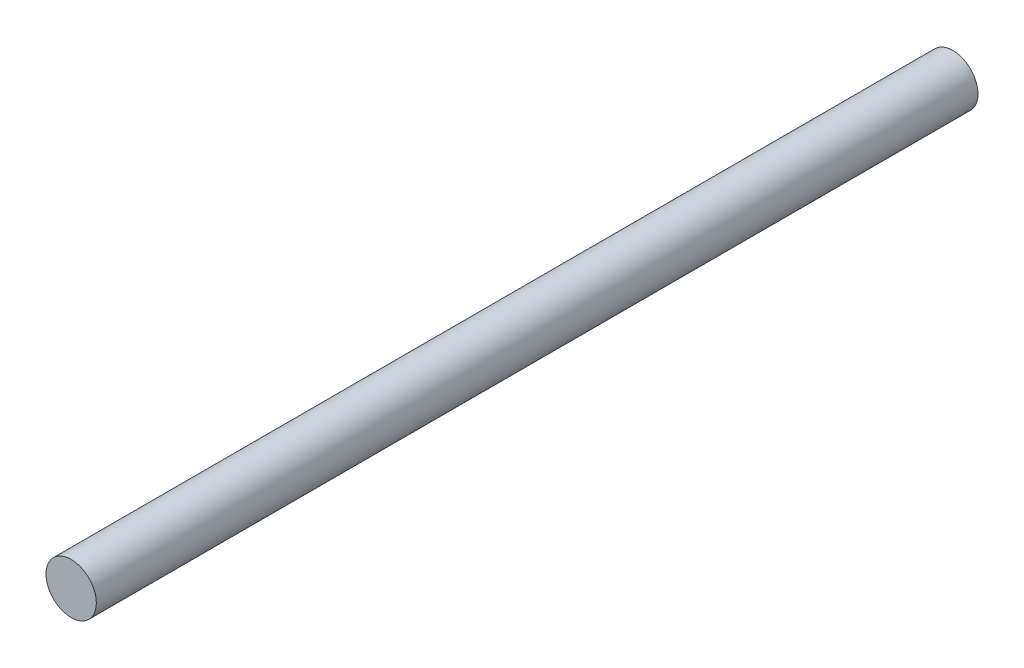
from build123d import *

# Parameters (mm, degrees)
ESBO_O1_R                = 4
RESSALTO_EXTRUS_O1_DEPTH = 140


with BuildPart() as part:
    # Esboço1 → Ressalto-extrusão1 (new body)
    with BuildSketch(Plane.XY):
        Circle(ESBO_O1_R)
    extrude(amount=RESSALTO_EXTRUS_O1_DEPTH)


solid = part.part
